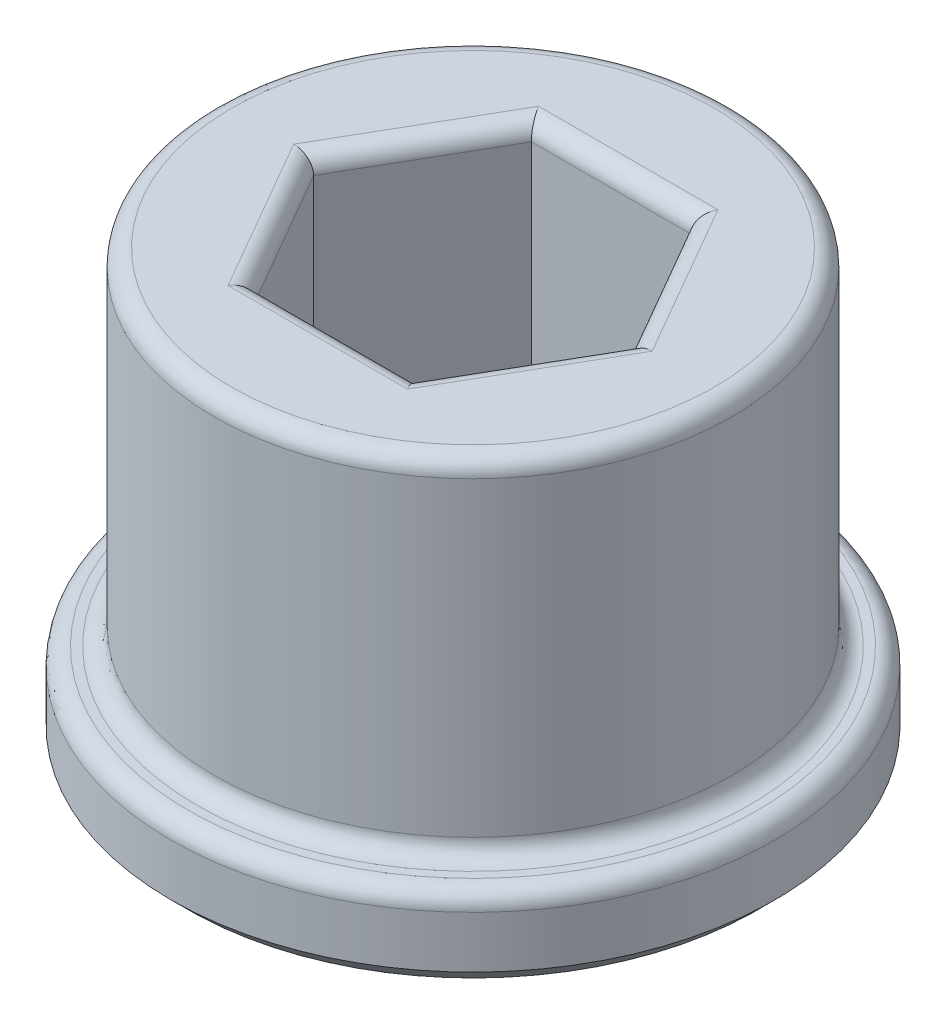
from build123d import *

# Parameters (mm, degrees)
SKETCH1_R           = 9.525
BOSS_EXTRUDE1_DEPTH = 7.9375
SKETCH2_R           = 9.525
BOSS_EXTRUDE2_DEPTH = 4.7625
SKETCH3_R           = 11.1125
BOSS_EXTRUDE3_DEPTH = 3.175
FILLET1_R           = 0.635
FILLET3_R           = 0.635
CHAMFER1_SIZE       = 0.635


with BuildPart() as part:
    # Sketch1 → Boss-Extrude1 (new body)
    with BuildSketch(Plane(origin=(0, 0, 0), x_dir=(1, 0, 0), z_dir=(0, 1, 0))):
        with Locations(Location((0, 0, 0), (0, 0, 270))):
            Circle(SKETCH1_R)
        Polygon((5.865878735, 0), (2.932939367, 5.08), (-2.932939367, 5.08), (-5.865878735, 0), (-2.932939367, -5.08), (2.932939367, -5.08), align=None, mode=Mode.SUBTRACT)
    extrude(amount=BOSS_EXTRUDE1_DEPTH)

    # Sketch2 → Boss-Extrude2 (add)
    with BuildSketch(Plane(origin=(0, 7.9375, 0), x_dir=(1, 0, 0), z_dir=(0, 1, 0))):
        with Locations(Location((0, 0, 0), (0, 0, 270))):
            Circle(SKETCH2_R)
        Polygon((-2.932939367, 5.08), (-5.865878735, 0), (-2.932939367, -5.08), (2.932939367, -5.08), (5.865878735, 0), (2.932939367, 5.08), align=None, mode=Mode.SUBTRACT)
    extrude(amount=BOSS_EXTRUDE2_DEPTH)

    # Sketch3 → Boss-Extrude3 (add)
    with BuildSketch(Plane.XZ):
        with Locations(Location((0, 0, 0), (0, 0, 270))):
            Circle(SKETCH3_R)
        Polygon((-2.932939367, 5.08), (2.932939367, 5.08), (5.865878735, 0), (2.932939367, -5.08), (-2.932939367, -5.08), (-5.865878735, 0), align=None, mode=Mode.SUBTRACT)
    extrude(amount=BOSS_EXTRUDE3_DEPTH)

    # Fillet1
    fillet1_edges = [part.edges().sort_by_distance(p)[0] for p in [
        (0, 0, -9.525),
        (0, 0, 11.1125),
    ]]
    fillet(fillet1_edges, radius=FILLET1_R)

    # Fillet3
    fillet3_edges = [part.edges().sort_by_distance(p)[0] for p in [
        (0, 12.7, -9.525),
        (0, 12.7, -5.08),
        (-4.399409051, 12.7, -2.54),
        (-4.399409051, 12.7, 2.54),
        (0, 12.7, 5.08),
        (4.399409051, 12.7, 2.54),
        (4.399409051, 12.7, -2.54),
    ]]
    fillet(fillet3_edges, radius=FILLET3_R)

    # Chamfer1
    chamfer1_edges = [part.edges().sort_by_distance(p)[0] for p in [
        (0, -3.175, 11.1125),
        (-4.399409051, -3.175, 2.54),
        (-4.399409051, -3.175, -2.54),
        (0, -3.175, -5.08),
        (4.399409051, -3.175, -2.54),
        (4.399409051, -3.175, 2.54),
        (0, -3.175, 5.08),
    ]]
    chamfer(chamfer1_edges, length=CHAMFER1_SIZE)


solid = part.part
